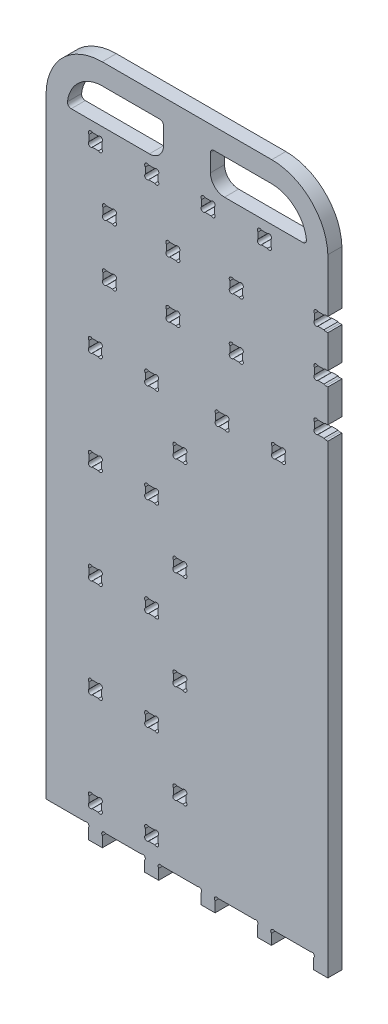
from build123d import *

# Parameters (mm, degrees)
BOSS_EXTRUDE1_DEPTH = 19.05


with BuildPart() as part:
    # Sketch1 → Boss-Extrude1 (new body)
    with BuildSketch(Plane.XY):
        with BuildLine():
            Line((305.17417212, 869.663870515), (75.865902141, 869.663870515))
            ThreePointArc((75.865902141, 869.663870515), (22.203646215, 847.426301097), (0, 793.75))
            Line((0, 793.75), (0, -31.75))
            Line((0, -31.75), (52.976414819, -31.75))
            ThreePointArc((52.976414819, -31.75), (57.23732397, -32.295247533), (57.055137848, -36.58703619))
            Line((57.055137848, -36.58703619), (57.055137848, -50.8))
            Line((57.055137848, -50.8), (76.105137848, -50.8))
            Line((76.105137848, -50.8), (76.105137848, -36.58703619))
            ThreePointArc((76.105137848, -36.58703619), (75.922951726, -32.295247533), (80.183860877, -31.75))
            Line((80.183860877, -31.75), (129.176414819, -31.75))
            ThreePointArc((129.176414819, -31.75), (133.43732397, -32.295247533), (133.255137848, -36.58703619))
            Line((133.255137848, -36.58703619), (133.255137848, -50.8))
            Line((133.255137848, -50.8), (152.305137848, -50.8))
            Line((152.305137848, -50.8), (152.305137848, -36.58703619))
            ThreePointArc((152.305137848, -36.58703619), (152.122951726, -32.295247533), (156.383860877, -31.75))
            Line((156.383860877, -31.75), (205.376414819, -31.75))
            ThreePointArc((205.376414819, -31.75), (209.63732397, -32.295247533), (209.455137848, -36.58703619))
            Line((209.455137848, -36.58703619), (209.455137848, -50.8))
            Line((209.455137848, -50.8), (228.505137848, -50.8))
            Line((228.505137848, -50.8), (228.505137848, -36.58703619))
            ThreePointArc((228.505137848, -36.58703619), (228.322951726, -32.295247533), (232.583860877, -31.75))
            Line((232.583860877, -31.75), (281.576414819, -31.75))
            ThreePointArc((281.576414819, -31.75), (285.83732397, -32.295247533), (285.655137848, -36.58703619))
            Line((285.655137848, -36.58703619), (285.655137848, -50.8))
            Line((285.655137848, -50.8), (304.705137848, -50.8))
            Line((304.705137848, -50.8), (304.705137848, -36.58703619))
            ThreePointArc((304.705137848, -36.58703619), (304.522951726, -32.295247533), (308.783860877, -31.75))
            Line((308.783860877, -31.75), (357.776414819, -31.75))
            ThreePointArc((357.776414819, -31.75), (362.03732397, -32.295247533), (361.855137848, -36.58703619))
            Line((361.855137848, -36.58703619), (361.855137848, -50.8))
            Line((361.855137848, -50.8), (381, -50.8))
            Line((381, -50.8), (381, 577.884091871))
            Line((381, 577.884091871), (378.141211783, 577.84438093))
            ThreePointArc((378.141211783, 577.84438093), (376.878861621, 578.068245337), (375.807957999, 578.773091871))
            Line((375.807957999, 578.773091871), (367.51621412, 578.773091871))
            ThreePointArc((367.51621412, 578.773091871), (363.02608606, 578.773091871), (363.02608606, 583.263219931))
            Line((363.02608606, 583.263219931), (363.02608606, 591.55496381))
            ThreePointArc((363.02608606, 591.55496381), (363.02608606, 596.045091871), (367.51621412, 596.045091871))
            Line((367.51621412, 596.045091871), (375.807957999, 596.045091871))
            ThreePointArc((375.807957999, 596.045091871), (376.878861621, 596.749938404), (378.141211783, 596.973802811))
            Line((378.141211783, 596.973802811), (381, 596.934091871))
            Line((381, 596.934091871), (381, 641.384091871))
            Line((381, 641.384091871), (378.141211783, 641.34438093))
            ThreePointArc((378.141211783, 641.34438093), (376.878861621, 641.568245337), (375.807957999, 642.273091871))
            Line((375.807957999, 642.273091871), (367.51621412, 642.273091871))
            ThreePointArc((367.51621412, 642.273091871), (363.02608606, 642.273091871), (363.02608606, 646.763219931))
            Line((363.02608606, 646.763219931), (363.02608606, 655.05496381))
            ThreePointArc((363.02608606, 655.05496381), (363.02608606, 659.545091871), (367.51621412, 659.545091871))
            Line((367.51621412, 659.545091871), (375.807957999, 659.545091871))
            ThreePointArc((375.807957999, 659.545091871), (376.878861621, 660.249938404), (378.141211783, 660.473802811))
            Line((378.141211783, 660.473802811), (381, 660.434091871))
            Line((381, 660.434091871), (381, 704.884091871))
            Line((381, 704.884091871), (378.141211783, 704.84438093))
            ThreePointArc((378.141211783, 704.84438093), (376.878861621, 705.068245337), (375.807957999, 705.773091871))
            Line((375.807957999, 705.773091871), (367.51621412, 705.773091871))
            ThreePointArc((367.51621412, 705.773091871), (363.02608606, 705.773091871), (363.02608606, 710.263219931))
            Line((363.02608606, 710.263219931), (363.02608606, 718.55496381))
            ThreePointArc((363.02608606, 718.55496381), (363.02608606, 723.045091871), (367.51621412, 723.045091871))
            Line((367.51621412, 723.045091871), (375.807957999, 723.045091871))
            ThreePointArc((375.807957999, 723.045091871), (376.878861621, 723.749938404), (378.141211783, 723.973802811))
            Line((378.141211783, 723.973802811), (381, 723.934091871))
            Line((381, 723.934091871), (381, 796.263968914))
            ThreePointArc((381, 796.263968914), (357.940405946, 848.308153869), (305.17417212, 869.663870515))
        make_face()
        with BuildLine():
            ThreePointArc((62.434265909, -11.811), (57.944137848, -11.811), (57.944137848, -7.320871939))
            Line((57.944137848, -7.320871939), (57.944137848, 0.970871939))
            ThreePointArc((57.944137848, 0.970871939), (57.944137848, 5.461), (62.434265909, 5.461))
            Line((62.434265909, 5.461), (70.726009788, 5.461))
            ThreePointArc((70.726009788, 5.461), (75.216137848, 5.461), (75.216137848, 0.970871939))
            Line((75.216137848, 0.970871939), (75.216137848, -7.320871939))
            ThreePointArc((75.216137848, -7.320871939), (75.216137848, -11.811), (70.726009788, -11.811))
            Line((70.726009788, -11.811), (62.434265909, -11.811))
        make_face(mode=Mode.SUBTRACT)
        with BuildLine():
            ThreePointArc((62.434265909, 121.539), (57.944137848, 121.539), (57.944137848, 126.029128061))
            Line((57.944137848, 126.029128061), (57.944137848, 134.320871939))
            ThreePointArc((57.944137848, 134.320871939), (57.944137848, 138.811), (62.434265909, 138.811))
            Line((62.434265909, 138.811), (70.726009788, 138.811))
            ThreePointArc((70.726009788, 138.811), (75.216137848, 138.811), (75.216137848, 134.320871939))
            Line((75.216137848, 134.320871939), (75.216137848, 126.029128061))
            ThreePointArc((75.216137848, 126.029128061), (75.216137848, 121.539), (70.726009788, 121.539))
            Line((70.726009788, 121.539), (62.434265909, 121.539))
        make_face(mode=Mode.SUBTRACT)
        with BuildLine():
            ThreePointArc((138.634265909, -11.811), (134.144137848, -11.811), (134.144137848, -7.320871939))
            Line((134.144137848, -7.320871939), (134.144137848, 0.970871939))
            ThreePointArc((134.144137848, 0.970871939), (134.144137848, 5.461), (138.634265909, 5.461))
            Line((138.634265909, 5.461), (146.926009788, 5.461))
            ThreePointArc((146.926009788, 5.461), (151.416137848, 5.461), (151.416137848, 0.970871939))
            Line((151.416137848, 0.970871939), (151.416137848, -7.320871939))
            ThreePointArc((151.416137848, -7.320871939), (151.416137848, -11.811), (146.926009788, -11.811))
            Line((146.926009788, -11.811), (138.634265909, -11.811))
        make_face(mode=Mode.SUBTRACT)
        with BuildLine():
            ThreePointArc((176.734265909, 54.864), (172.244137848, 54.864), (172.244137848, 59.354128061))
            Line((172.244137848, 59.354128061), (172.244137848, 67.645871939))
            ThreePointArc((172.244137848, 67.645871939), (172.244137848, 72.136), (176.734265909, 72.136))
            Line((176.734265909, 72.136), (185.026009788, 72.136))
            ThreePointArc((185.026009788, 72.136), (189.516137848, 72.136), (189.516137848, 67.645871939))
            Line((189.516137848, 67.645871939), (189.516137848, 59.354128061))
            ThreePointArc((189.516137848, 59.354128061), (189.516137848, 54.864), (185.026009788, 54.864))
            Line((185.026009788, 54.864), (176.734265909, 54.864))
        make_face(mode=Mode.SUBTRACT)
        with BuildLine():
            ThreePointArc((138.634265909, 121.539), (134.144137848, 121.539), (134.144137848, 126.029128061))
            Line((134.144137848, 126.029128061), (134.144137848, 134.320871939))
            ThreePointArc((134.144137848, 134.320871939), (134.144137848, 138.811), (138.634265909, 138.811))
            Line((138.634265909, 138.811), (146.926009788, 138.811))
            ThreePointArc((146.926009788, 138.811), (151.416137848, 138.811), (151.416137848, 134.320871939))
            Line((151.416137848, 134.320871939), (151.416137848, 126.029128061))
            ThreePointArc((151.416137848, 126.029128061), (151.416137848, 121.539), (146.926009788, 121.539))
            Line((146.926009788, 121.539), (138.634265909, 121.539))
        make_face(mode=Mode.SUBTRACT)
        with BuildLine():
            ThreePointArc((62.434265909, 254.889), (57.944137848, 254.889), (57.944137848, 259.379128061))
            Line((57.944137848, 259.379128061), (57.944137848, 267.670871939))
            ThreePointArc((57.944137848, 267.670871939), (57.944137848, 272.161), (62.434265909, 272.161))
            Line((62.434265909, 272.161), (70.726009788, 272.161))
            ThreePointArc((70.726009788, 272.161), (75.216137848, 272.161), (75.216137848, 267.670871939))
            Line((75.216137848, 267.670871939), (75.216137848, 259.379128061))
            ThreePointArc((75.216137848, 259.379128061), (75.216137848, 254.889), (70.726009788, 254.889))
            Line((70.726009788, 254.889), (62.434265909, 254.889))
        make_face(mode=Mode.SUBTRACT)
        with BuildLine():
            ThreePointArc((62.434265909, 388.239), (57.944137848, 388.239), (57.944137848, 392.729128061))
            Line((57.944137848, 392.729128061), (57.944137848, 401.020871939))
            ThreePointArc((57.944137848, 401.020871939), (57.944137848, 405.511), (62.434265909, 405.511))
            Line((62.434265909, 405.511), (70.726009788, 405.511))
            ThreePointArc((70.726009788, 405.511), (75.216137848, 405.511), (75.216137848, 401.020871939))
            Line((75.216137848, 401.020871939), (75.216137848, 392.729128061))
            ThreePointArc((75.216137848, 392.729128061), (75.216137848, 388.239), (70.726009788, 388.239))
            Line((70.726009788, 388.239), (62.434265909, 388.239))
        make_face(mode=Mode.SUBTRACT)
        with BuildLine():
            ThreePointArc((138.634265909, 254.889), (134.144137848, 254.889), (134.144137848, 259.379128061))
            Line((134.144137848, 259.379128061), (134.144137848, 267.670871939))
            ThreePointArc((134.144137848, 267.670871939), (134.144137848, 272.161), (138.634265909, 272.161))
            Line((138.634265909, 272.161), (146.926009788, 272.161))
            ThreePointArc((146.926009788, 272.161), (151.416137848, 272.161), (151.416137848, 267.670871939))
            Line((151.416137848, 267.670871939), (151.416137848, 259.379128061))
            ThreePointArc((151.416137848, 259.379128061), (151.416137848, 254.889), (146.926009788, 254.889))
            Line((146.926009788, 254.889), (138.634265909, 254.889))
        make_face(mode=Mode.SUBTRACT)
        with BuildLine():
            ThreePointArc((176.734265909, 188.214), (172.244137848, 188.214), (172.244137848, 192.704128061))
            Line((172.244137848, 192.704128061), (172.244137848, 200.995871939))
            ThreePointArc((172.244137848, 200.995871939), (172.244137848, 205.486), (176.734265909, 205.486))
            Line((176.734265909, 205.486), (185.026009788, 205.486))
            ThreePointArc((185.026009788, 205.486), (189.516137848, 205.486), (189.516137848, 200.995871939))
            Line((189.516137848, 200.995871939), (189.516137848, 192.704128061))
            ThreePointArc((189.516137848, 192.704128061), (189.516137848, 188.214), (185.026009788, 188.214))
            Line((185.026009788, 188.214), (176.734265909, 188.214))
        make_face(mode=Mode.SUBTRACT)
        with BuildLine():
            ThreePointArc((138.634265909, 388.239), (134.144137848, 388.239), (134.144137848, 392.729128061))
            Line((134.144137848, 392.729128061), (134.144137848, 401.020871939))
            ThreePointArc((134.144137848, 401.020871939), (134.144137848, 405.511), (138.634265909, 405.511))
            Line((138.634265909, 405.511), (146.926009788, 405.511))
            ThreePointArc((146.926009788, 405.511), (151.416137848, 405.511), (151.416137848, 401.020871939))
            Line((151.416137848, 401.020871939), (151.416137848, 392.729128061))
            ThreePointArc((151.416137848, 392.729128061), (151.416137848, 388.239), (146.926009788, 388.239))
            Line((146.926009788, 388.239), (138.634265909, 388.239))
        make_face(mode=Mode.SUBTRACT)
        with BuildLine():
            ThreePointArc((176.734265909, 321.564), (172.244137848, 321.564), (172.244137848, 326.054128061))
            Line((172.244137848, 326.054128061), (172.244137848, 334.345871939))
            ThreePointArc((172.244137848, 334.345871939), (172.244137848, 338.836), (176.734265909, 338.836))
            Line((176.734265909, 338.836), (185.026009788, 338.836))
            ThreePointArc((185.026009788, 338.836), (189.516137848, 338.836), (189.516137848, 334.345871939))
            Line((189.516137848, 334.345871939), (189.516137848, 326.054128061))
            ThreePointArc((189.516137848, 326.054128061), (189.516137848, 321.564), (185.026009788, 321.564))
            Line((185.026009788, 321.564), (176.734265909, 321.564))
        make_face(mode=Mode.SUBTRACT)
        with BuildLine():
            ThreePointArc((62.434265909, 521.589), (57.944137848, 521.589), (57.944137848, 526.079128061))
            Line((57.944137848, 526.079128061), (57.944137848, 534.370871939))
            ThreePointArc((57.944137848, 534.370871939), (57.944137848, 538.861), (62.434265909, 538.861))
            Line((62.434265909, 538.861), (70.726009788, 538.861))
            ThreePointArc((70.726009788, 538.861), (75.216137848, 538.861), (75.216137848, 534.370871939))
            Line((75.216137848, 534.370871939), (75.216137848, 526.079128061))
            ThreePointArc((75.216137848, 526.079128061), (75.216137848, 521.589), (70.726009788, 521.589))
            Line((70.726009788, 521.589), (62.434265909, 521.589))
        make_face(mode=Mode.SUBTRACT)
        with BuildLine():
            ThreePointArc((81.579128061, 610.489), (77.089, 610.489), (77.089, 614.979128061))
            Line((77.089, 614.979128061), (77.089, 623.270871939))
            ThreePointArc((77.089, 623.270871939), (77.089, 627.761), (81.579128061, 627.761))
            Line((81.579128061, 627.761), (89.870871939, 627.761))
            ThreePointArc((89.870871939, 627.761), (94.361, 627.761), (94.361, 623.270871939))
            Line((94.361, 623.270871939), (94.361, 614.979128061))
            ThreePointArc((94.361, 614.979128061), (94.361, 610.489), (89.870871939, 610.489))
            Line((89.870871939, 610.489), (81.579128061, 610.489))
        make_face(mode=Mode.SUBTRACT)
        with BuildLine():
            ThreePointArc((176.734265909, 454.914), (172.244137848, 454.914), (172.244137848, 459.404128061))
            Line((172.244137848, 459.404128061), (172.244137848, 467.695871939))
            ThreePointArc((172.244137848, 467.695871939), (172.244137848, 472.186), (176.734265909, 472.186))
            Line((176.734265909, 472.186), (185.026009788, 472.186))
            ThreePointArc((185.026009788, 472.186), (189.516137848, 472.186), (189.516137848, 467.695871939))
            Line((189.516137848, 467.695871939), (189.516137848, 459.404128061))
            ThreePointArc((189.516137848, 459.404128061), (189.516137848, 454.914), (185.026009788, 454.914))
            Line((185.026009788, 454.914), (176.734265909, 454.914))
        make_face(mode=Mode.SUBTRACT)
        with BuildLine():
            ThreePointArc((138.634265909, 521.589), (134.144137848, 521.589), (134.144137848, 526.079128061))
            Line((134.144137848, 526.079128061), (134.144137848, 534.370871939))
            ThreePointArc((134.144137848, 534.370871939), (134.144137848, 538.861), (138.634265909, 538.861))
            Line((138.634265909, 538.861), (146.926009788, 538.861))
            ThreePointArc((146.926009788, 538.861), (151.416137848, 538.861), (151.416137848, 534.370871939))
            Line((151.416137848, 534.370871939), (151.416137848, 526.079128061))
            ThreePointArc((151.416137848, 526.079128061), (151.416137848, 521.589), (146.926009788, 521.589))
            Line((146.926009788, 521.589), (138.634265909, 521.589))
        make_face(mode=Mode.SUBTRACT)
        with BuildLine():
            ThreePointArc((167.304128061, 610.489), (162.814, 610.489), (162.814, 614.979128061))
            Line((162.814, 614.979128061), (162.814, 623.270871939))
            ThreePointArc((162.814, 623.270871939), (162.814, 627.761), (167.304128061, 627.761))
            Line((167.304128061, 627.761), (175.595871939, 627.761))
            ThreePointArc((175.595871939, 627.761), (180.086, 627.761), (180.086, 623.270871939))
            Line((180.086, 623.270871939), (180.086, 614.979128061))
            ThreePointArc((180.086, 614.979128061), (180.086, 610.489), (175.595871939, 610.489))
            Line((175.595871939, 610.489), (167.304128061, 610.489))
        make_face(mode=Mode.SUBTRACT)
        with BuildLine():
            ThreePointArc((81.579128061, 686.689), (77.089, 686.689), (77.089, 691.179128061))
            Line((77.089, 691.179128061), (77.089, 699.470871939))
            ThreePointArc((77.089, 699.470871939), (77.089, 703.961), (81.579128061, 703.961))
            Line((81.579128061, 703.961), (89.870871939, 703.961))
            ThreePointArc((89.870871939, 703.961), (94.361, 703.961), (94.361, 699.470871939))
            Line((94.361, 699.470871939), (94.361, 691.179128061))
            ThreePointArc((94.361, 691.179128061), (94.361, 686.689), (89.870871939, 686.689))
            Line((89.870871939, 686.689), (81.579128061, 686.689))
        make_face(mode=Mode.SUBTRACT)
        with BuildLine():
            ThreePointArc((62.529128061, 762.889), (58.039, 762.889), (58.039, 767.379128061))
            Line((58.039, 767.379128061), (58.039, 775.670871939))
            ThreePointArc((58.039, 775.670871939), (58.039, 780.161), (62.529128061, 780.161))
            Line((62.529128061, 780.161), (70.820871939, 780.161))
            ThreePointArc((70.820871939, 780.161), (75.311, 780.161), (75.311, 775.670871939))
            Line((75.311, 775.670871939), (75.311, 767.379128061))
            ThreePointArc((75.311, 767.379128061), (75.311, 762.889), (70.820871939, 762.889))
            Line((70.820871939, 762.889), (62.529128061, 762.889))
        make_face(mode=Mode.SUBTRACT)
        with BuildLine():
            Line((158.75, 836.295), (158.75, 812.8))
            ThreePointArc((158.75, 812.8), (153.170384182, 799.329615818), (139.7, 793.75))
            Line((139.7, 793.75), (33.959372341, 793.75))
            ThreePointArc((33.959372341, 793.75), (30.158861771, 795.459166364), (28.915715307, 799.436567164))
            ThreePointArc((28.915715307, 799.436567164), (44.598434661, 829.379786599), (76.2, 841.375))
            Line((76.2, 841.375), (153.67, 841.375))
            ThreePointArc((153.67, 841.375), (157.262102448, 839.887102448), (158.75, 836.295))
        make_face(mode=Mode.SUBTRACT)
        with BuildLine():
            ThreePointArc((167.304128061, 686.689), (162.814, 686.689), (162.814, 691.179128061))
            Line((162.814, 691.179128061), (162.814, 699.470871939))
            ThreePointArc((162.814, 699.470871939), (162.814, 703.961), (167.304128061, 703.961))
            Line((167.304128061, 703.961), (175.595871939, 703.961))
            ThreePointArc((175.595871939, 703.961), (180.086, 703.961), (180.086, 699.470871939))
            Line((180.086, 699.470871939), (180.086, 691.179128061))
            ThreePointArc((180.086, 691.179128061), (180.086, 686.689), (175.595871939, 686.689))
            Line((175.595871939, 686.689), (167.304128061, 686.689))
        make_face(mode=Mode.SUBTRACT)
        with BuildLine():
            ThreePointArc((138.729128061, 762.889), (134.239, 762.889), (134.239, 767.379128061))
            Line((134.239, 767.379128061), (134.239, 775.670871939))
            ThreePointArc((134.239, 775.670871939), (134.239, 780.161), (138.729128061, 780.161))
            Line((138.729128061, 780.161), (147.020871939, 780.161))
            ThreePointArc((147.020871939, 780.161), (151.511, 780.161), (151.511, 775.670871939))
            Line((151.511, 775.670871939), (151.511, 767.379128061))
            ThreePointArc((151.511, 767.379128061), (151.511, 762.889), (147.020871939, 762.889))
            Line((147.020871939, 762.889), (138.729128061, 762.889))
        make_face(mode=Mode.SUBTRACT)
        with BuildLine():
            ThreePointArc((233.884265909, 521.451299467), (229.394137848, 521.451299467), (229.394137848, 525.941427528))
            Line((229.394137848, 525.941427528), (229.394137848, 534.233171407))
            ThreePointArc((229.394137848, 534.233171407), (229.394137848, 538.723299467), (233.884265909, 538.723299467))
            Line((233.884265909, 538.723299467), (242.176009788, 538.723299467))
            ThreePointArc((242.176009788, 538.723299467), (246.666137848, 538.723299467), (246.666137848, 534.233171407))
            Line((246.666137848, 534.233171407), (246.666137848, 525.941427528))
            ThreePointArc((246.666137848, 525.941427528), (246.666137848, 521.451299467), (242.176009788, 521.451299467))
            Line((242.176009788, 521.451299467), (233.884265909, 521.451299467))
        make_face(mode=Mode.SUBTRACT)
        with BuildLine():
            ThreePointArc((253.029128061, 610.489), (248.539, 610.489), (248.539, 614.979128061))
            Line((248.539, 614.979128061), (248.539, 623.270871939))
            ThreePointArc((248.539, 623.270871939), (248.539, 627.761), (253.029128061, 627.761))
            Line((253.029128061, 627.761), (261.320871939, 627.761))
            ThreePointArc((261.320871939, 627.761), (265.811, 627.761), (265.811, 623.270871939))
            Line((265.811, 623.270871939), (265.811, 614.979128061))
            ThreePointArc((265.811, 614.979128061), (265.811, 610.489), (261.320871939, 610.489))
            Line((261.320871939, 610.489), (253.029128061, 610.489))
        make_face(mode=Mode.SUBTRACT)
        with BuildLine():
            ThreePointArc((310.084265909, 521.451299467), (305.594137848, 521.451299467), (305.594137848, 525.941427528))
            Line((305.594137848, 525.941427528), (305.594137848, 534.233171407))
            ThreePointArc((305.594137848, 534.233171407), (305.594137848, 538.723299467), (310.084265909, 538.723299467))
            Line((310.084265909, 538.723299467), (318.376009788, 538.723299467))
            ThreePointArc((318.376009788, 538.723299467), (322.866137848, 538.723299467), (322.866137848, 534.233171407))
            Line((322.866137848, 534.233171407), (322.866137848, 525.941427528))
            ThreePointArc((322.866137848, 525.941427528), (322.866137848, 521.451299467), (318.376009788, 521.451299467))
            Line((318.376009788, 521.451299467), (310.084265909, 521.451299467))
        make_face(mode=Mode.SUBTRACT)
        with BuildLine():
            ThreePointArc((253.029128061, 686.689), (248.539, 686.689), (248.539, 691.179128061))
            Line((248.539, 691.179128061), (248.539, 699.470871939))
            ThreePointArc((248.539, 699.470871939), (248.539, 703.961), (253.029128061, 703.961))
            Line((253.029128061, 703.961), (261.320871939, 703.961))
            ThreePointArc((261.320871939, 703.961), (265.811, 703.961), (265.811, 699.470871939))
            Line((265.811, 699.470871939), (265.811, 691.179128061))
            ThreePointArc((265.811, 691.179128061), (265.811, 686.689), (261.320871939, 686.689))
            Line((261.320871939, 686.689), (253.029128061, 686.689))
        make_face(mode=Mode.SUBTRACT)
        with BuildLine():
            ThreePointArc((214.929128061, 762.889), (210.439, 762.889), (210.439, 767.379128061))
            Line((210.439, 767.379128061), (210.439, 775.670871939))
            ThreePointArc((210.439, 775.670871939), (210.439, 780.161), (214.929128061, 780.161))
            Line((214.929128061, 780.161), (223.220871939, 780.161))
            ThreePointArc((223.220871939, 780.161), (227.711, 780.161), (227.711, 775.670871939))
            Line((227.711, 775.670871939), (227.711, 767.379128061))
            ThreePointArc((227.711, 767.379128061), (227.711, 762.889), (223.220871939, 762.889))
            Line((223.220871939, 762.889), (214.929128061, 762.889))
        make_face(mode=Mode.SUBTRACT)
        with BuildLine():
            ThreePointArc((291.129128061, 762.889), (286.639, 762.889), (286.639, 767.379128061))
            Line((286.639, 767.379128061), (286.639, 775.670871939))
            ThreePointArc((286.639, 775.670871939), (286.639, 780.161), (291.129128061, 780.161))
            Line((291.129128061, 780.161), (299.420871939, 780.161))
            ThreePointArc((299.420871939, 780.161), (303.911, 780.161), (303.911, 775.670871939))
            Line((303.911, 775.670871939), (303.911, 767.379128061))
            ThreePointArc((303.911, 767.379128061), (303.911, 762.889), (299.420871939, 762.889))
            Line((299.420871939, 762.889), (291.129128061, 762.889))
        make_face(mode=Mode.SUBTRACT)
        with BuildLine():
            ThreePointArc((222.25, 836.295), (223.737897552, 839.887102448), (227.33, 841.375))
            Line((227.33, 841.375), (304.8, 841.375))
            ThreePointArc((304.8, 841.375), (336.401565339, 829.379786599), (352.084284693, 799.436567164))
            ThreePointArc((352.084284693, 799.436567164), (350.841138229, 795.459166364), (347.040627659, 793.75))
            Line((347.040627659, 793.75), (241.3, 793.75))
            ThreePointArc((241.3, 793.75), (227.829615818, 799.329615818), (222.25, 812.8))
            Line((222.25, 812.8), (222.25, 836.295))
        make_face(mode=Mode.SUBTRACT)
    extrude(amount=BOSS_EXTRUDE1_DEPTH)


solid = part.part
